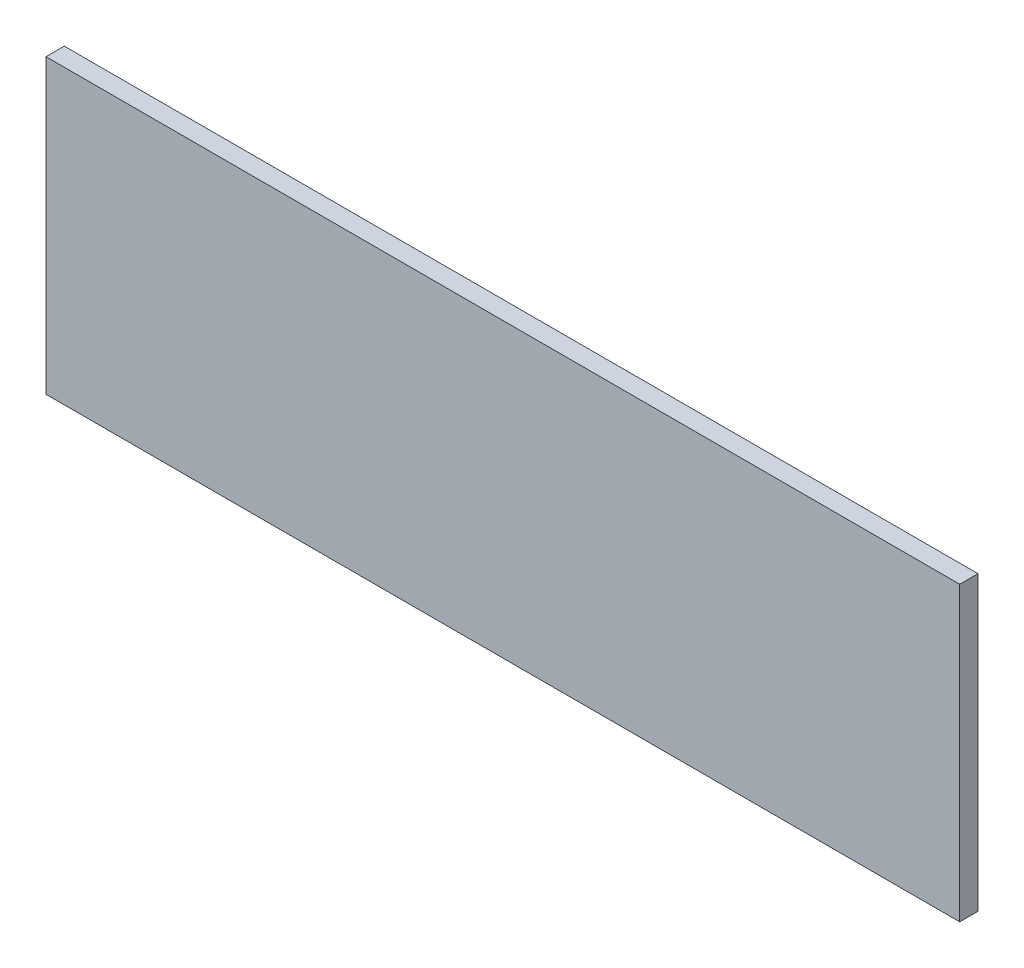
from build123d import *

# Parameters (mm, degrees)
SKETCH1_W           = 1000
SKETCH1_H           = 320
BOSS_EXTRUDE1_DEPTH = 20


with BuildPart() as part:
    # Sketch1 → Boss-Extrude1 (new body)
    with BuildSketch(Plane.XY):
        with Locations((134.343434343, 55.95959596)):
            Rectangle(SKETCH1_W, SKETCH1_H)
    extrude(amount=BOSS_EXTRUDE1_DEPTH)


solid = part.part
